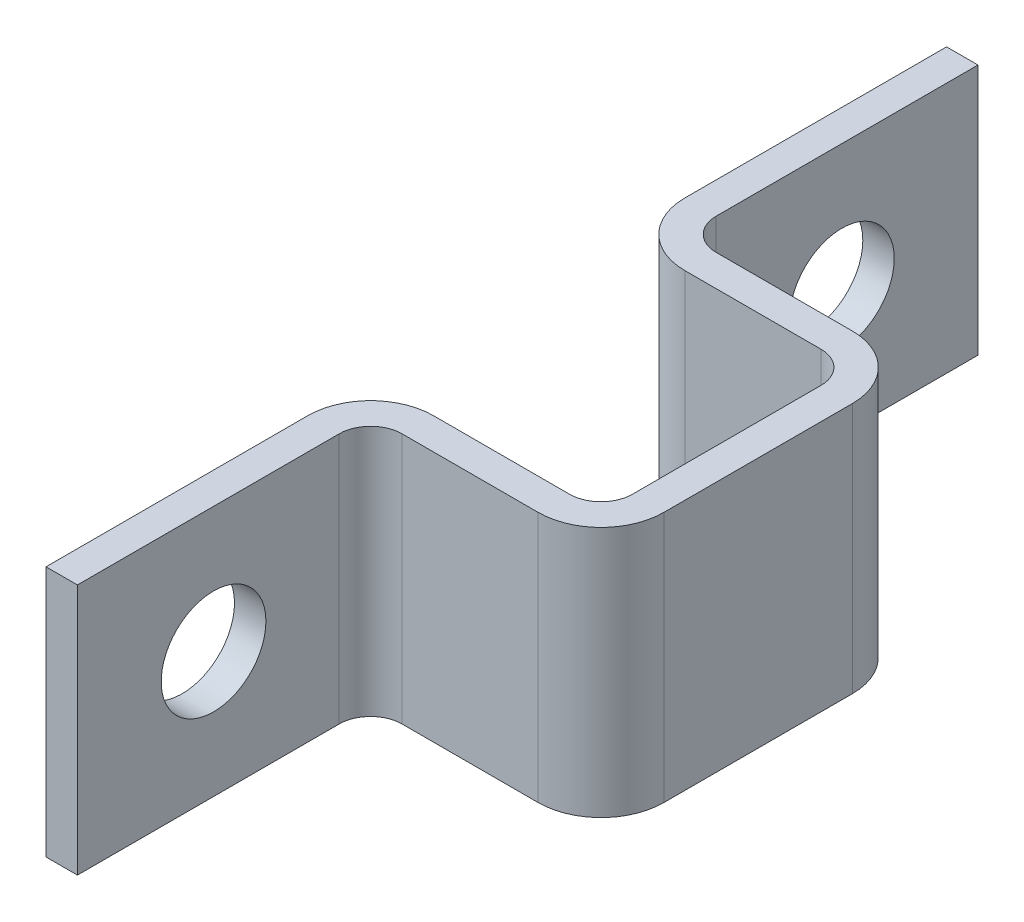
from build123d import *

# Parameters (mm, degrees)
EXTRUDE_THIN1_DEPTH = 12
SKETCH2_R           = 2.5
CUT_EXTRUDE1_DEPTH  = 28.613402543


with BuildPart() as part:
    # Sketch1 → Extrude-Thin1 (new body)
    with BuildSketch(Plane(origin=(0, 0, 0), x_dir=(1, 0, 0), z_dir=(0, 1, 0))):
        with BuildLine():
            Line((0, 21.5), (0, 9))
            ThreePointArc((0, 9), (0.878679656, 6.878679656), (3, 6))
            Line((3, 6), (9.5, 6))
            ThreePointArc((9.5, 6), (10.560660172, 5.560660172), (11, 4.5))
            Line((11, 4.5), (11, -4.5))
            ThreePointArc((11, -4.5), (10.560660172, -5.560660172), (9.5, -6))
            Line((9.5, -6), (3, -6))
            ThreePointArc((3, -6), (0.878679656, -6.878679656), (0, -9))
            Line((0, -9), (0, -21.5))
            Line((0, -21.5), (1.5, -21.5))
            Line((1.5, -21.5), (1.5, -9))
            ThreePointArc((1.5, -9), (1.939339828, -7.939339828), (3, -7.5))
            Line((3, -7.5), (9.5, -7.5))
            ThreePointArc((9.5, -7.5), (11.621320344, -6.621320344), (12.5, -4.5))
            Line((12.5, -4.5), (12.5, 4.5))
            ThreePointArc((12.5, 4.5), (11.621320344, 6.621320344), (9.5, 7.5))
            Line((9.5, 7.5), (3, 7.5))
            ThreePointArc((3, 7.5), (1.939339828, 7.939339828), (1.5, 9))
            Line((1.5, 9), (1.5, 21.5))
            Line((1.5, 21.5), (0, 21.5))
        make_face()
    extrude(amount=EXTRUDE_THIN1_DEPTH)

    # Sketch2 → Cut-Extrude1 (cut, through all)
    with BuildSketch(Plane(origin=(0, 0, 0), x_dir=(0, 0, -1), z_dir=(1, 0, 0))):
        with Locations((-15, 6)):
            Circle(SKETCH2_R)
        with Locations((15, 6)):
            Circle(SKETCH2_R)
    extrude(amount=CUT_EXTRUDE1_DEPTH, mode=Mode.SUBTRACT)


solid = part.part
